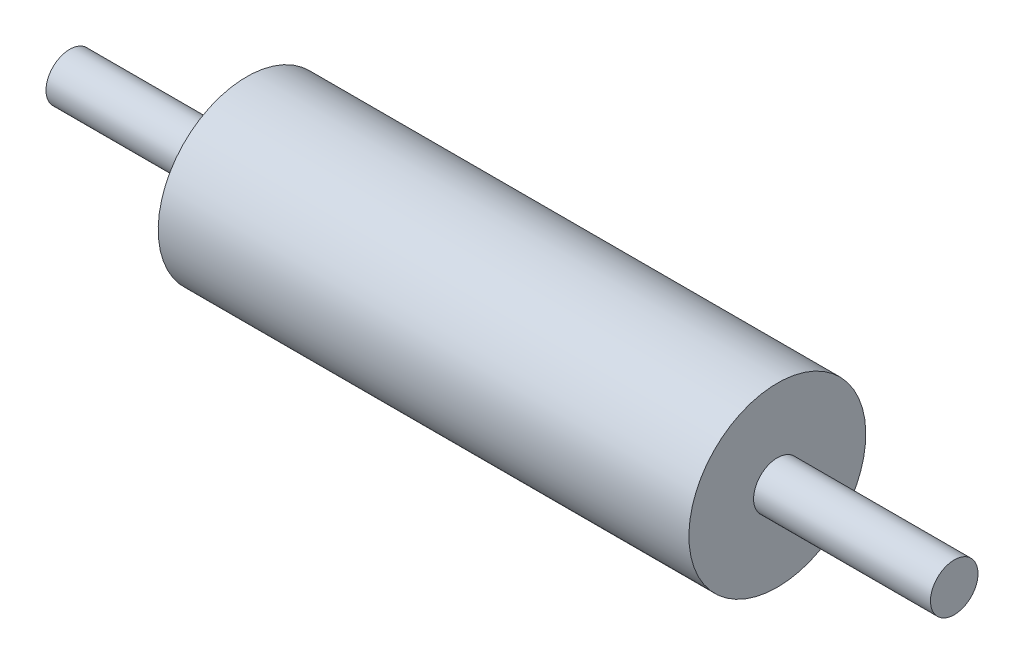
from build123d import *


with BuildPart() as part:
    # Sketch4 → Revolve2 (revolve)
    with BuildSketch(Plane.XY, mode=Mode.PRIVATE) as revolve2_sk:
        Polygon((0, 0), (10, 0), (10, 0.268728711), (8, 0.268728711), (8, 1), (2, 1), (2, 0.268728711), (0, 0.268728711), align=None)
    revolve(revolve2_sk.sketch.rotate(Axis((0, 0, 0), (1, 0, 0)), 180), axis=Axis((0, 0, 0), (1, 0, 0)))


solid = part.part
